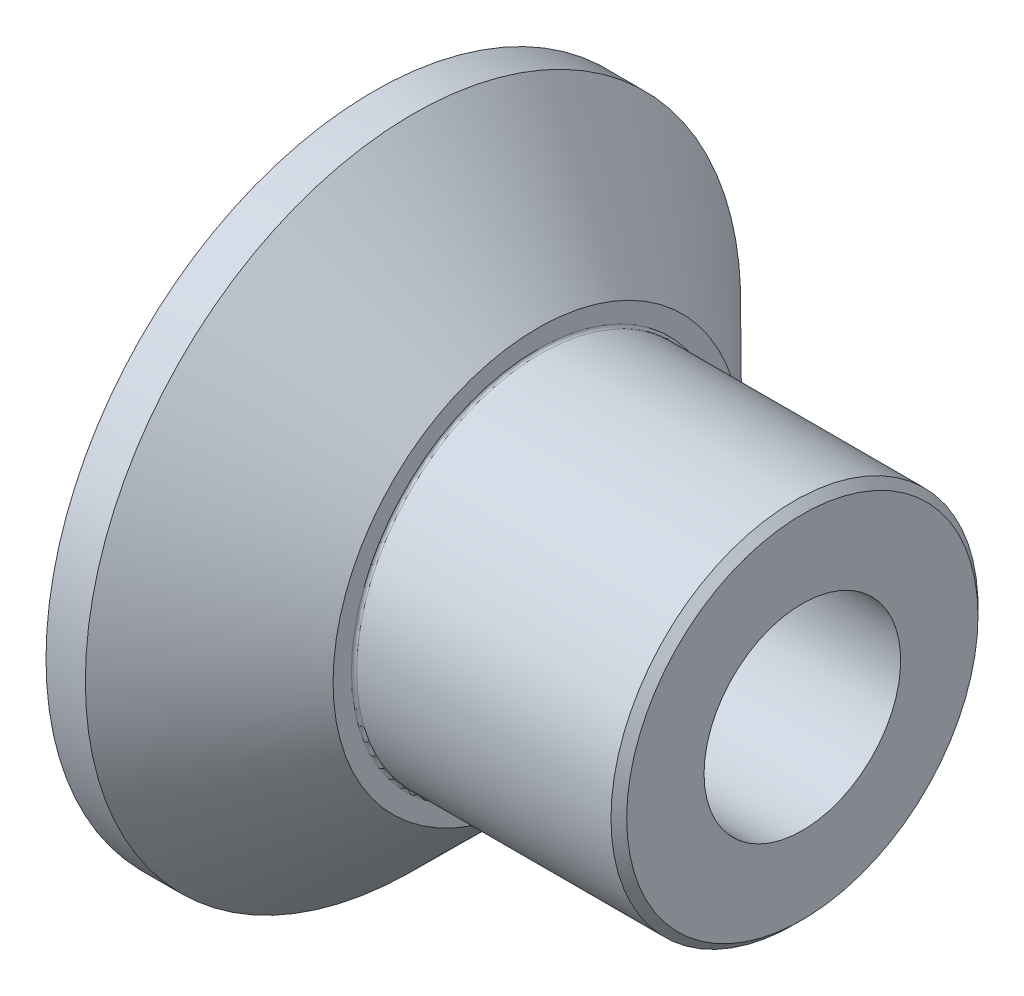
from build123d import *

# Parameters (mm, degrees)
FILLET_1_R     = 1
CHAMFER_1_SIZE = 3


with BuildPart() as part:
    # 草图1 → 旋转1 (revolve)
    with BuildSketch(Plane.XY, mode=Mode.PRIVATE) as revolve_1_sk:
        Polygon((0, 0), (-120.5, 0), (-120.5, 17.5), (-163.5, 72.5), (-163.5, 87.5), (-148.5, 87.5), (-101, 40.5), (-101, 32.5), (0, 32.5), align=None)
    revolve(revolve_1_sk.sketch.rotate(Axis((-120.5, -37.5, 0), (1, 0, 0)), 90), axis=Axis((-120.5, -37.5, 0), (1, 0, 0)))

    # 圆角1
    fillet_1_edges = [part.edges().sort_by_distance(p)[0] for p in [
        (-101, -37.5, -70),
    ]]
    fillet(fillet_1_edges, radius=FILLET_1_R)

    # 倒角1
    chamfer_1_edges = [part.edges().sort_by_distance(p)[0] for p in [
        (0, -37.5, -70),
    ]]
    chamfer(chamfer_1_edges, length=CHAMFER_1_SIZE)


solid = part.part
